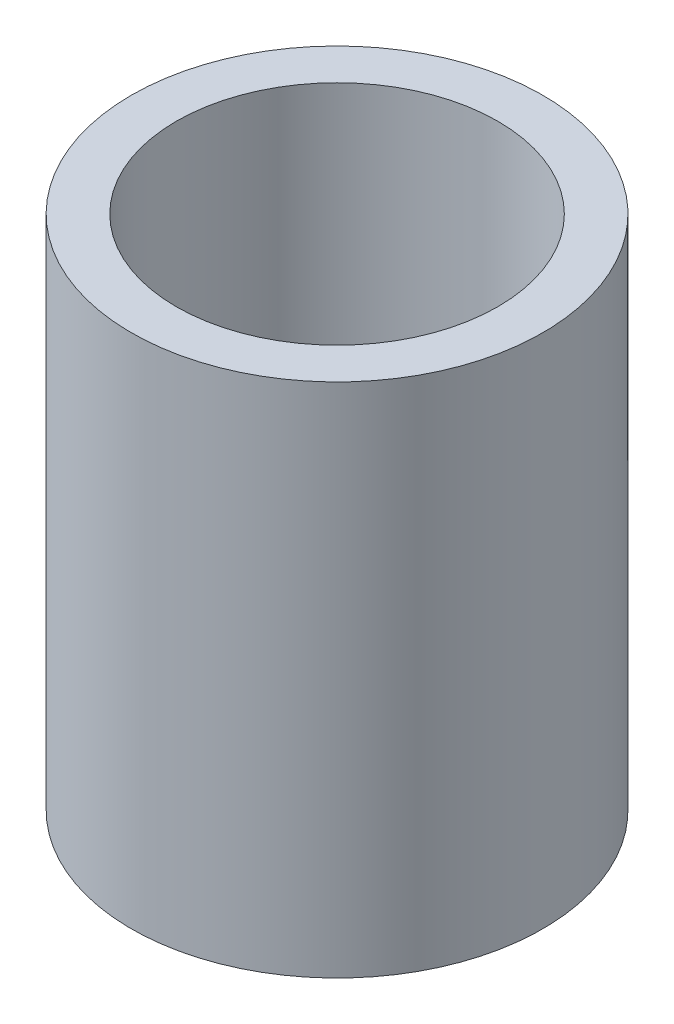
from build123d import *

# Parameters (mm, degrees)
SKETCH1_W               = 16
SKETCH1_H               = 40.15
CUT_EXTRUDE1_DEPTH      = 47.087118591
CUT_EXTRUDE1_DEPTH_BACK = 47.087118591
SKETCH2_R               = 12.5


with BuildPart() as part:
    # Sketch1 → Revolve1 (revolve)
    with BuildSketch(Plane.XY):
        with Locations((8, -18.814470918)):
            Rectangle(SKETCH1_W, SKETCH1_H)
    revolve(axis=Axis((0, 1.260529082, 0), (0, -1, 0)))

    # Sketch2 → Cut-Extrude1 (cut, two sides: drawn at the far end of the back side and taken through both)
    with BuildSketch(Plane(origin=(0, 1.260529082, 0), x_dir=(1, 0, 0), z_dir=(0, 1, 0)).offset(-CUT_EXTRUDE1_DEPTH_BACK)):
        Circle(SKETCH2_R)
    extrude(amount=CUT_EXTRUDE1_DEPTH + CUT_EXTRUDE1_DEPTH_BACK, mode=Mode.SUBTRACT)


solid = part.part
